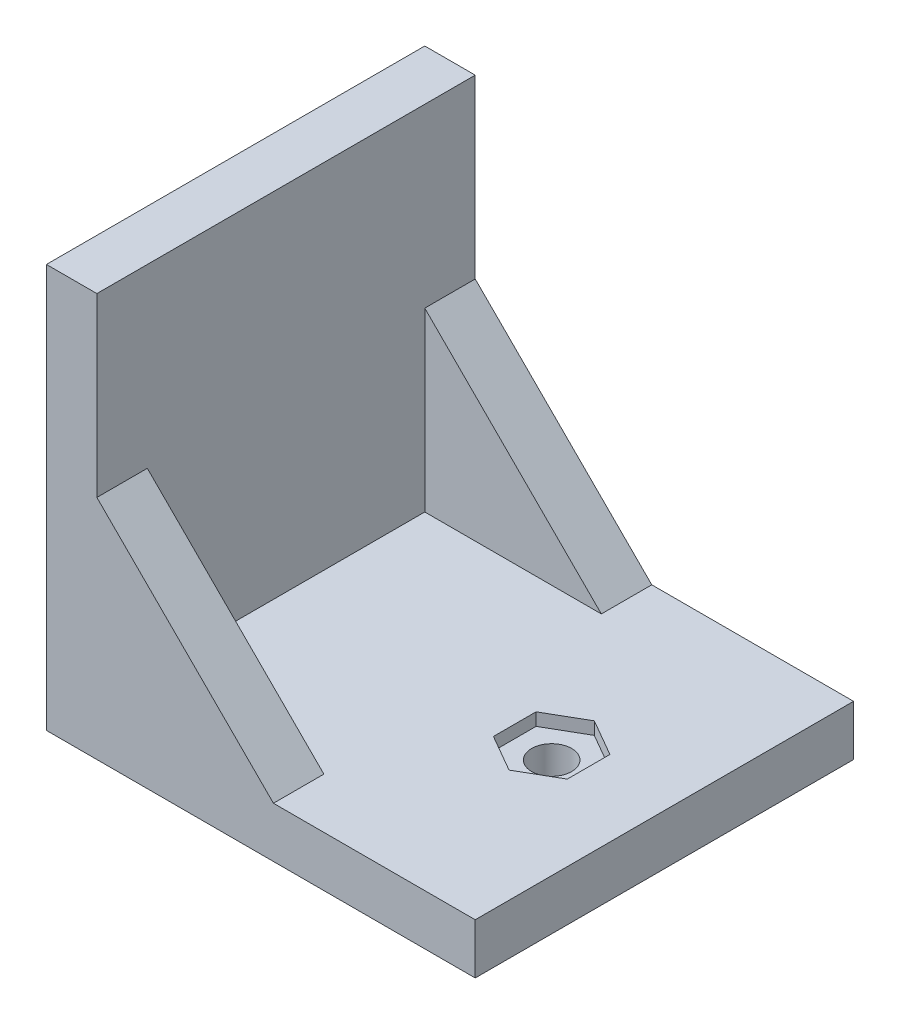
from build123d import *

# Parameters (mm, degrees)
SKETCH1_W           = 68
SKETCH1_H           = 60
BOSS_EXTRUDE1_DEPTH = 8
SKETCH4_W           = 8
SKETCH4_H           = 60
BOSS_EXTRUDE2_DEPTH = 56
SKETCH5_R           = 3.175
CUT_EXTRUDE1_DEPTH  = 8
CUT_EXTRUDE2_DEPTH  = 2
BOSS_EXTRUDE3_DEPTH = 8


with BuildPart() as part:
    # Sketch1 → Boss-Extrude1 (new body)
    with BuildSketch(Plane(origin=(0, 0, 0), x_dir=(1, 0, 0), z_dir=(0, 1, 0))):
        with Locations((34, 30)):
            Rectangle(SKETCH1_W, SKETCH1_H)
    extrude(amount=BOSS_EXTRUDE1_DEPTH)

    # Sketch4 → Boss-Extrude2 (add)
    with BuildSketch(Plane(origin=(0, 8, 0), x_dir=(1, 0, 0), z_dir=(0, 1, 0))):
        with Locations((4, 30)):
            Rectangle(SKETCH4_W, SKETCH4_H)
    extrude(amount=BOSS_EXTRUDE2_DEPTH)

    # Sketch5 → Cut-Extrude1 (cut)
    with BuildSketch(Plane(origin=(0, 8, 0), x_dir=(1, 0, 0), z_dir=(0, 1, 0))):
        with Locations(Location((50.125, 30, 0), (0, 0, 270))):
            Circle(SKETCH5_R)
    extrude(amount=-CUT_EXTRUDE1_DEPTH, mode=Mode.SUBTRACT)

    # Sketch7 → Cut-Extrude2 (cut)
    with BuildSketch(Plane(origin=(0, 8, 0), x_dir=(1, 0, 0), z_dir=(0, 1, 0))):
        Polygon((44.26875, 26.618892486), (50.125, 23.237784972), (55.98125, 26.618892486), (55.98125, 33.381107514), (50.125, 36.762215028), (44.26875, 33.381107514), align=None)
    extrude(amount=-CUT_EXTRUDE2_DEPTH, mode=Mode.SUBTRACT)

    # Sketch8 → Boss-Extrude3 (add)
    with BuildSketch(Plane(origin=(0, 0, -60), x_dir=(-1, 0, 0), z_dir=(0, 0, -1))):
        Polygon((-36, 8), (-8, 8), (-8, 36), align=None)
    boss_extrude3 = extrude(amount=-BOSS_EXTRUDE3_DEPTH)

    # Mirror1: Boss-Extrude3 across plane
    add(boss_extrude3.mirror(Plane(origin=(0, 0, -30), x_dir=(1, 0, 0), z_dir=(0, 0, -1))))


solid = part.part
